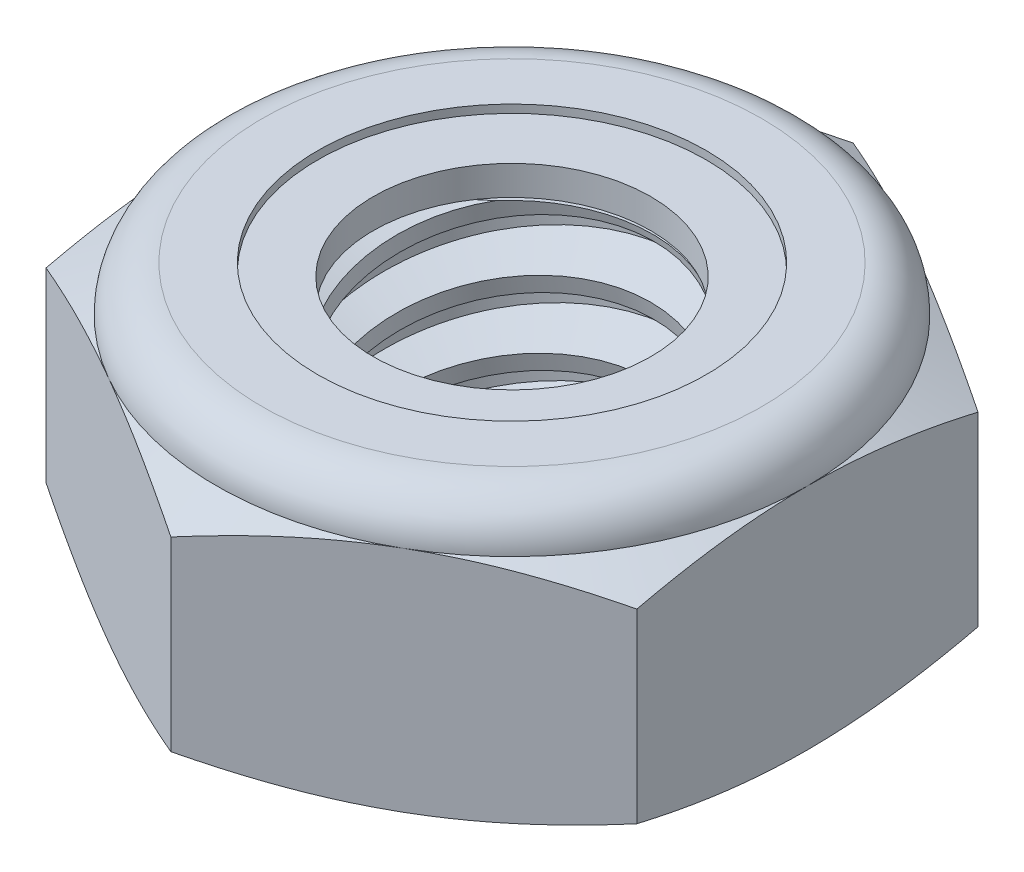
from build123d import *

# Parameters (mm, degrees)
EXTRUDE1_DEPTH      = 5.159375
SKETCH2_W           = 3.175
SKETCH2_H           = 5.159375
LPATTERN1_COUNT     = 4
LPATTERN1_PITCH     = 1.27
LPATTERN1_COL_COUNT = 2
LPATTERN1_COL_PITCH = 1.27


with BuildPart() as part:
    # Sketch1 → Extrude1 (new body)
    with BuildSketch(Plane(origin=(0, 0, 0), x_dir=(1, 0, 0), z_dir=(0, 1, 0))):
        Polygon((0, 6.415804866), (-5.55625, 3.207902433), (-5.55625, -3.207902433), (0, -6.415804866), (5.55625, -3.207902433), (5.55625, 3.207902433), align=None)
    extrude(amount=EXTRUDE1_DEPTH)

    # Sketch4 → Cut-Revolve2 (revolve, cut)
    with BuildSketch(Plane(origin=(0, 0, 0), x_dir=(0, 0, -1), z_dir=(1, 0, 0)), mode=Mode.PRIVATE) as cut_revolve2_sk:
        Polygon((0, 5.159375), (3.175, 5.159375), (2.609908356, 4.895868439), (2.609908356, 0.263506561), (3.175, 0), (0, 0), align=None)
    revolve(cut_revolve2_sk.sketch.rotate(Axis((0, 5.159375, 0), (0, 1, 0)), 34.505533911), axis=Axis((0, 5.159375, 0), (0, 1, 0)), mode=Mode.SUBTRACT)


with BuildPart() as body_2:
    # Sketch2 → Revolve1 (revolve)
    with BuildSketch(Plane(origin=(0, 0, 0), x_dir=(0, 0, -1), z_dir=(1, 0, 0))):
        with Locations((1.5875, 2.5796875)):
            Rectangle(SKETCH2_W, SKETCH2_H)
    revolve(axis=Axis((0, -3.175, 0), (0, 1, 0)))

    # Sketch3 → Cut-Revolve1 (revolve, cut)
    with BuildSketch(Plane(origin=(0, 0, 0), x_dir=(0, 0, -1), z_dir=(1, 0, 0)), mode=Mode.PRIVATE) as cut_revolve1_sk:
        Polygon((3.206133436, 5.003707818), (3.424067492, 3.914037542), (2.672175229, 4.168393763), (2.609908356, 4.479728128), align=None)
    cut_revolve1 = revolve(cut_revolve1_sk.sketch.rotate(Axis((0, 5.159375, 0.272704483), (0, -0.9805806756909202, -0.1961161351381843)), 180), axis=Axis((0, 5.159375, 0.272704483), (0, -0.9805806756909202, -0.1961161351381843)), mode=Mode.SUBTRACT)

    # LPattern1: Cut-Revolve1 ×4
    with Locations(*[(0, -i * LPATTERN1_PITCH, 0) for i in range(1, LPATTERN1_COUNT)]):
        add(cut_revolve1, mode=Mode.SUBTRACT)

    # LPattern1 col: Cut-Revolve1 ×2
    with Locations(*[(0, i * LPATTERN1_COL_PITCH, 0) for i in range(1, LPATTERN1_COL_COUNT)]):
        add(cut_revolve1, mode=Mode.SUBTRACT)


with BuildPart() as part_1:
    add(part.part)

    # Combine1: cut body 2
    add(body_2.part, mode=Mode.SUBTRACT)

    # Sketch5 → Cut-Revolve3 (revolve, cut)
    with BuildSketch(Plane(origin=(0, 0, 0), x_dir=(0, 0, -1), z_dir=(1, 0, 0)), mode=Mode.PRIVATE) as cut_revolve3_sk:
        with BuildLine():
            Line((0, 0), (5.55625, 0))
            Line((5.55625, 0), (6.415804866, 0.400817017))
            Line((6.415804866, 0.400817017), (6.415804866, 3.89866215))
            Line((6.415804866, 3.89866215), (5.55625, 4.299479167))
            ThreePointArc((5.55625, 4.299479167), (5.304392342, 4.907517342), (4.696354167, 5.159375))
            Line((4.696354167, 5.159375), (4.696354167, 6.429375))
            Line((4.696354167, 6.429375), (7.685804866, 6.429375))
            Line((7.685804866, 6.429375), (7.685804866, -1.27))
            Line((7.685804866, -1.27), (0, -1.27))
            Line((0, -1.27), (0, 0))
        make_face()
    revolve(cut_revolve3_sk.sketch.rotate(Axis((0, 0, 0), (0, 1, 0)), 54.619043446), axis=Axis((0, 0, 0), (0, 1, 0)), mode=Mode.SUBTRACT)

    # Sketch6 → Cut-Revolve4 (revolve, cut)
    with BuildSketch(Plane(origin=(0, 0, 0), x_dir=(0, 0, -1), z_dir=(1, 0, 0)), mode=Mode.PRIVATE) as cut_revolve4_sk:
        with BuildLine():
            Line((0, 4.299479167), (5.40385, 4.299479167))
            ThreePointArc((5.40385, 4.299479167), (5.196629268, 4.799754268), (4.696354167, 5.006975))
            Line((4.696354167, 5.006975), (3.653131261, 5.006975))
            Line((3.653131261, 5.006975), (3.653131261, 6.429375))
            Line((3.653131261, 6.429375), (0, 6.429375))
            Line((0, 6.429375), (0, 4.299479167))
        make_face()
    revolve(cut_revolve4_sk.sketch.rotate(Axis((0, 6.429375, 0), (0, 1, 0)), 54.619043446), axis=Axis((0, 6.429375, 0), (0, 1, 0)), mode=Mode.SUBTRACT)


with BuildPart() as body_2_2:
    # Sketch7 → Revolve2 (revolve)
    with BuildSketch(Plane(origin=(0, 0, 0), x_dir=(0, 0, -1), z_dir=(1, 0, 0))):
        with BuildLine():
            Line((2.609908356, 4.375679167), (5.3230343, 4.375679167))
            ThreePointArc((5.3230343, 4.375679167), (5.114940888, 4.772046184), (4.696354167, 4.930775))
            Line((4.696354167, 4.930775), (2.609908356, 4.930775))
            Line((2.609908356, 4.930775), (2.609908356, 4.375679167))
        make_face()
    revolve(axis=Axis((0, 4.375679167, 0), (0, 1, 0)))


solid = Compound([part_1.part, body_2_2.part])
